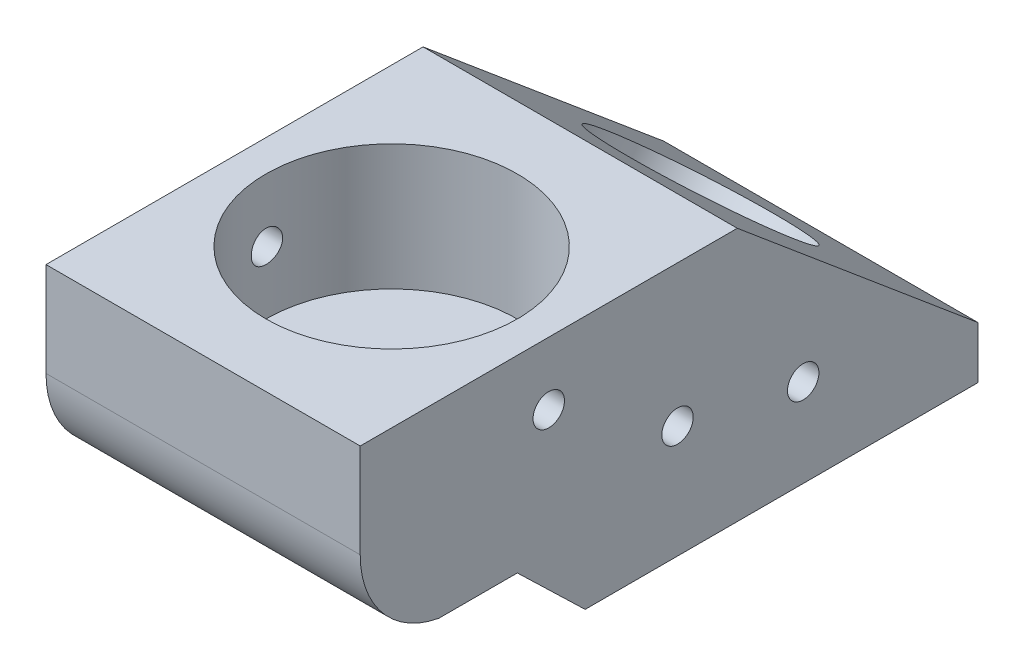
from build123d import *

# Parameters (mm, degrees)
BOSS_EXTRUDE1_DEPTH = 100
SKETCH3_R           = 40
CUT_EXTRUDE1_DEPTH  = 40
SKETCH4_R           = 30
CUT_EXTRUDE2_DEPTH  = 176.880963539
SKETCH5_R           = 5
CUT_EXTRUDE3_DEPTH  = 176.880963539
SKETCH6_R           = 5
CUT_EXTRUDE4_DEPTH  = 176.880963641
SKETCH7_R           = 5
CUT_EXTRUDE5_DEPTH  = 176.880963641
CUT_EXTRUDE7_DEPTH  = 176.880963641


with BuildPart() as part:
    # Sketch2 → Boss-Extrude1 (new body)
    with BuildSketch(Plane(origin=(0, 0, 0), x_dir=(0, 0, -1), z_dir=(1, 0, 0))):
        Polygon((0, 0), (-120, 0), (-120, -60), (-70, -60), (-48.414121025, -80.833862553), (29.789031359, -80.833862553), (76.604444312, -80.833862553), (76.604444312, -64.278760969), align=None)
    extrude(amount=-BOSS_EXTRUDE1_DEPTH)

    # Sketch3 → Cut-Extrude1 (cut)
    with BuildSketch(Plane(origin=(0, 0, 0), x_dir=(1, 0, 0), z_dir=(0, 1, 0))):
        with Locations(Location((-50, -60, 0), (0, 0, 270))):
            Circle(SKETCH3_R)
    extrude(amount=-CUT_EXTRUDE1_DEPTH, mode=Mode.SUBTRACT)

    # Sketch4 → Cut-Extrude2 (cut, through all)
    with BuildSketch(Plane(origin=(0, 0, 0), x_dir=(1, 0, 0), z_dir=(0, 0.7660444431189771, -0.6427876096865404))):
        with Locations(Location((-50, 50, 0), (0, 0, 270))):
            Circle(SKETCH4_R)
    extrude(amount=-CUT_EXTRUDE2_DEPTH, mode=Mode.SUBTRACT)

    # Sketch5 → Cut-Extrude3 (cut, through all)
    with BuildSketch(Plane(origin=(0, 0, 0), x_dir=(0, 0, -1), z_dir=(1, 0, 0))):
        with Locations((20.976095068, -52.787854687)):
            Circle(SKETCH5_R)
    extrude(amount=-CUT_EXTRUDE3_DEPTH, mode=Mode.SUBTRACT)

    # Sketch6 → Cut-Extrude4 (cut, through all)
    with BuildSketch(Plane(origin=(0, 0, 0), x_dir=(0, 0, -1), z_dir=(1, 0, 0))):
        with Locations((-19.023904932, -45)):
            Circle(SKETCH6_R)
    extrude(amount=-CUT_EXTRUDE4_DEPTH, mode=Mode.SUBTRACT)

    # Sketch7 → Cut-Extrude5 (cut, through all)
    with BuildSketch(Plane(origin=(0, 0, 0), x_dir=(0, 0, -1), z_dir=(1, 0, 0))):
        with Locations((-60, -20)):
            Circle(SKETCH7_R)
    extrude(amount=-CUT_EXTRUDE5_DEPTH, mode=Mode.SUBTRACT)

    # Sketch8 → Cut-Extrude7 (cut, through all)
    with BuildSketch(Plane(origin=(0, 0, 0), x_dir=(0, 0, -1), z_dir=(1, 0, 0))):
        with BuildLine():
            Line((-120, -30), (-120, -60))
            Line((-120, -60), (-95, -60))
            ThreePointArc((-95, -60), (-112.930749028, -49.52562419), (-120, -30))
        make_face()
    extrude(amount=-CUT_EXTRUDE7_DEPTH, mode=Mode.SUBTRACT)


solid = part.part
